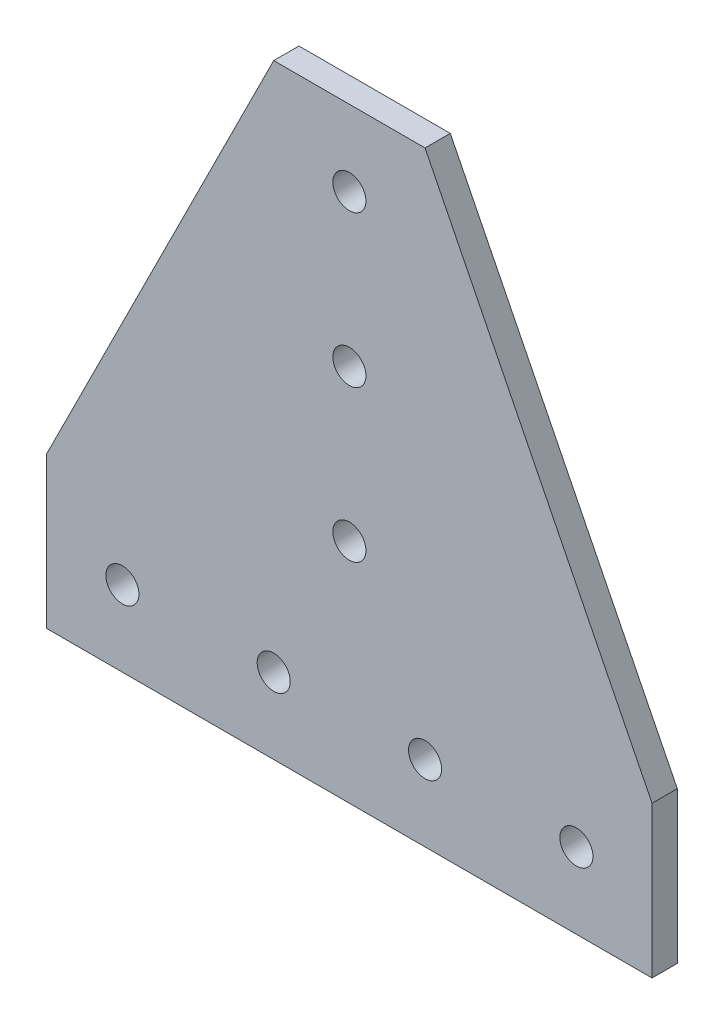
from build123d import *

# Parameters (mm, degrees)
SKETCH1_R           = 4.1656
BOSS_EXTRUDE1_DEPTH = 6.35


with BuildPart() as part:
    # Sketch1 → Boss-Extrude1 (new body)
    with BuildSketch(Plane.XY.offset(6.35)):
        Polygon((-19.05, 152.4), (-76.2, 38.1), (-76.2, 0), (76.2, 0), (76.2, 38.1), (19.05, 152.4), align=None)
        with Locations(Location((-57.15, 19.05, 0), (0, 0, 180))):
            Circle(SKETCH1_R, mode=Mode.SUBTRACT)
        with Locations(Location((-19.05, 19.05, 0), (0, 0, 180))):
            Circle(SKETCH1_R, mode=Mode.SUBTRACT)
        with Locations(Location((0, 133.35, 0), (0, 0, 180))):
            Circle(SKETCH1_R, mode=Mode.SUBTRACT)
        with Locations(Location((0, 95.25, 0), (0, 0, 180))):
            Circle(SKETCH1_R, mode=Mode.SUBTRACT)
        with Locations(Location((0, 57.15, 0), (0, 0, 180))):
            Circle(SKETCH1_R, mode=Mode.SUBTRACT)
        with Locations(Location((19.05, 19.05, 0), (0, 0, 180))):
            Circle(SKETCH1_R, mode=Mode.SUBTRACT)
        with Locations(Location((57.15, 19.05, 0), (0, 0, 180))):
            Circle(SKETCH1_R, mode=Mode.SUBTRACT)
    extrude(amount=-BOSS_EXTRUDE1_DEPTH)


solid = part.part
